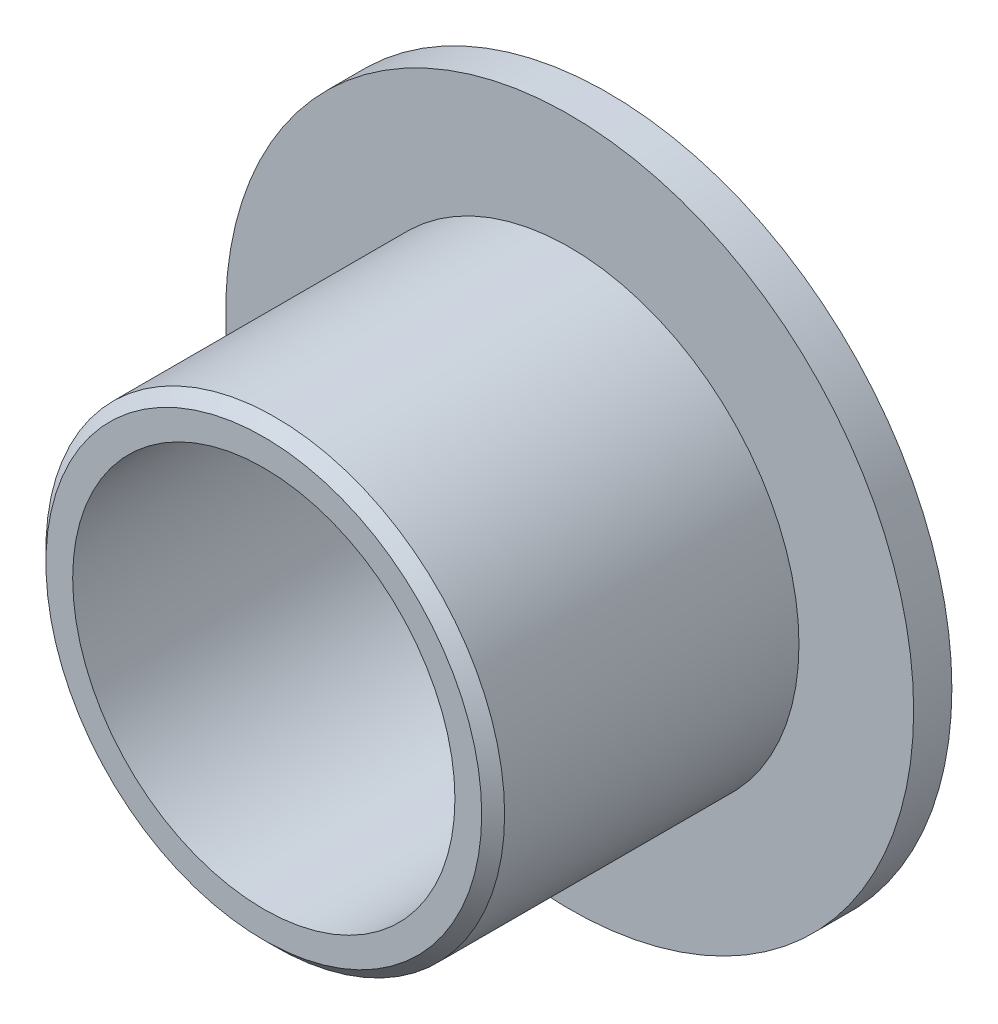
from build123d import *

# Parameters (mm, degrees)
SKETCH1_R           = 9
SKETCH1_R_2         = 5
BOSS_EXTRUDE1_DEPTH = 1
SKETCH2_R           = 6
SKETCH2_R_2         = 5
BOSS_EXTRUDE2_DEPTH = 8
CHAMFER1_SIZE       = 0.3


with BuildPart() as part:
    # Sketch1 → Boss-Extrude1 (new body)
    with BuildSketch(Plane.XY):
        Circle(SKETCH1_R)
        Circle(SKETCH1_R_2, mode=Mode.SUBTRACT)
    extrude(amount=BOSS_EXTRUDE1_DEPTH)

    # Sketch2 → Boss-Extrude2 (add)
    with BuildSketch(Plane.XY.offset(1)):
        Circle(SKETCH2_R)
        Circle(SKETCH2_R_2, mode=Mode.SUBTRACT)
    extrude(amount=BOSS_EXTRUDE2_DEPTH)

    # Chamfer1
    chamfer1_edges = [part.edges().sort_by_distance(p)[0] for p in [
        (-6, 0, 9),
    ]]
    chamfer(chamfer1_edges, length=CHAMFER1_SIZE)


solid = part.part
